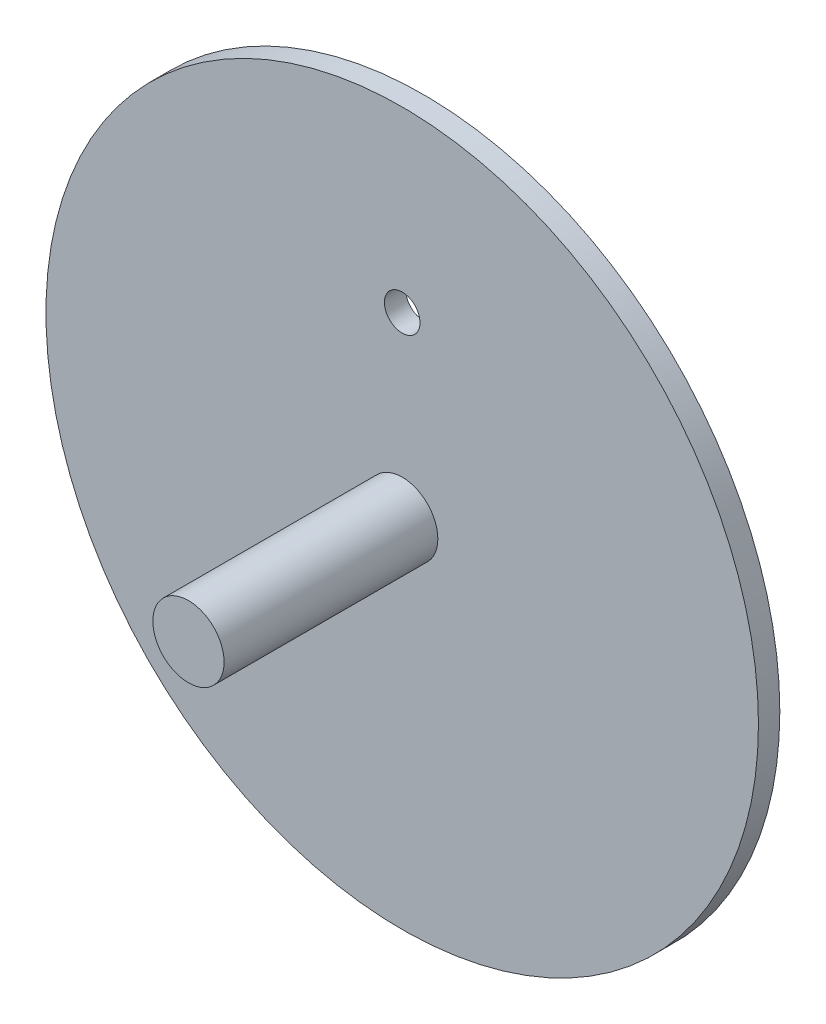
from build123d import *

# Parameters (mm, degrees)
SKETCH_1_R          = 50
EXTRUDE_1_DEPTH     = 3
SKETCH_2_R          = 5
EXTRUDE_2_DEPTH     = 30
SKETCH_3_R          = 2.5
CUT_EXTRUDE_1_DEPTH = 77.811457479


with BuildPart() as part:
    # Эскиз1 → Бобышка-Вытянуть1 (new body)
    with BuildSketch(Plane.XY):
        Circle(SKETCH_1_R)
    extrude(amount=EXTRUDE_1_DEPTH)

    # Эскиз2 → Бобышка-Вытянуть2 (add)
    with BuildSketch(Plane.XY.offset(3)):
        Circle(SKETCH_2_R)
    extrude(amount=EXTRUDE_2_DEPTH)

    # Эскиз3 → Вырез-Вытянуть1 (cut, through all)
    with BuildSketch(Plane.XY.offset(3)):
        with Locations((0, 25)):
            Circle(SKETCH_3_R)
    extrude(amount=-CUT_EXTRUDE_1_DEPTH, mode=Mode.SUBTRACT)


solid = part.part
